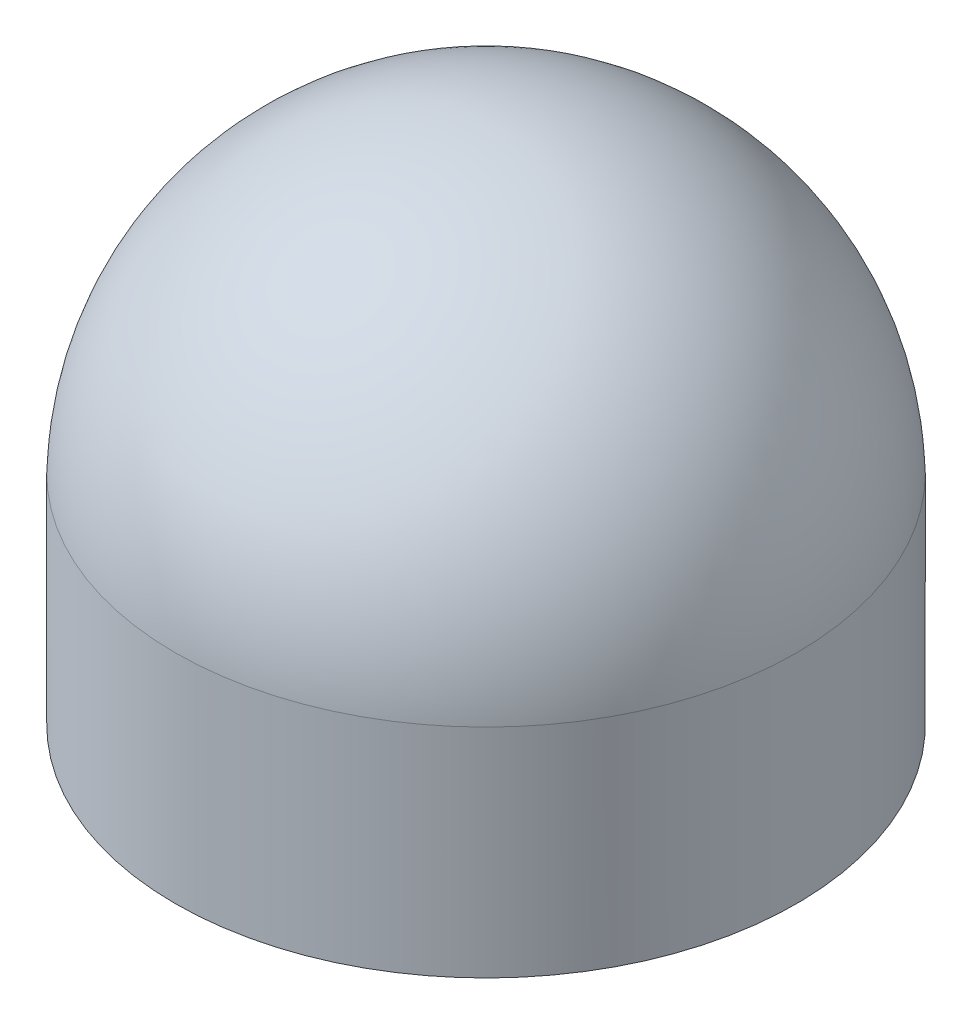
from build123d import *


with BuildPart() as part:
    # Sketch1 → Revolve3 (revolve)
    with BuildSketch(Plane(origin=(0, 0, 0), x_dir=(0, 0, -1), z_dir=(1, 0, 0)), mode=Mode.PRIVATE) as revolve3_sk:
        with BuildLine():
            Line((2.6, 0), (2.6, 2.5))
            ThreePointArc((2.6, 2.5), (1.80346888, 4.273607635), (0, 5))
            Line((0, 5), (0, 6))
            ThreePointArc((0, 6), (2.504206858, 4.987083238), (3.6, 2.518016666))
            Line((3.6, 2.518016666), (3.6, 0))
            Line((3.6, 0), (2.6, 0))
        make_face()
    revolve(revolve3_sk.sketch.rotate(Axis((0, 6, 0), (0, -1, 0)), 180), axis=Axis((0, 6, 0), (0, -1, 0)))


solid = part.part
